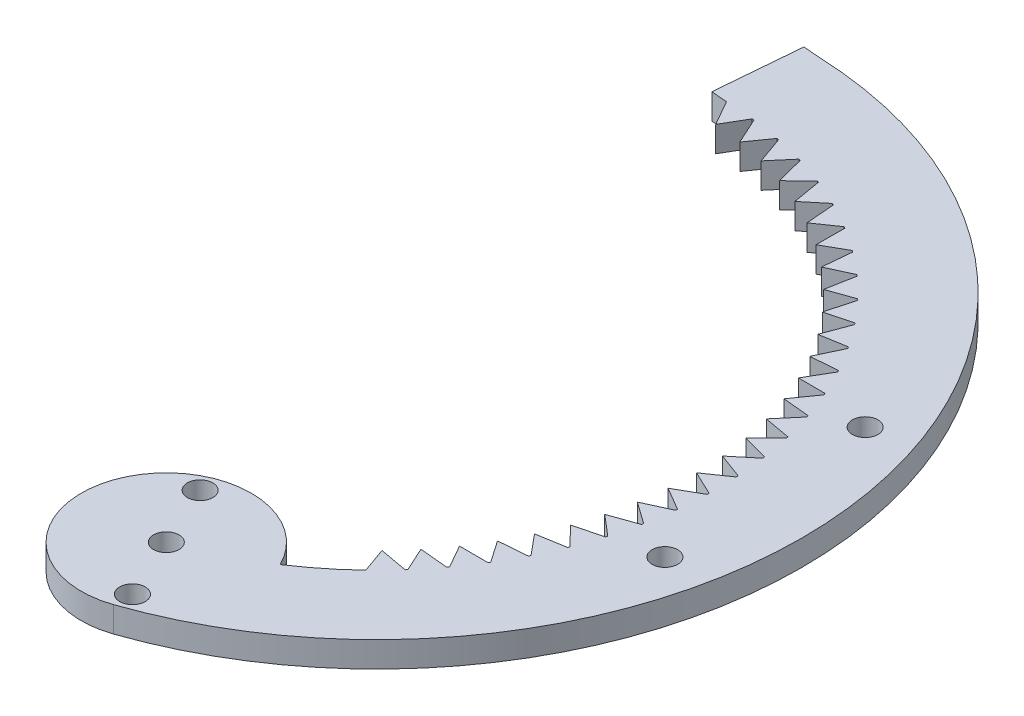
from build123d import *

# Parameters (mm, degrees)
SKETCH_1_R          = 1.5
EXTRUDE_1_DEPTH     = 3
SKETCH_2_R          = 1.5
CUT_EXTRUDE_1_DEPTH = 35
SKETCH_3_R          = 1.5
CUT_EXTRUDE_2_DEPTH = 10


with BuildPart() as part:
    # 草图1 → 凸台-拉伸1 (new body)
    with BuildSketch(Plane(origin=(0, 0, 0), x_dir=(1, 0, 0), z_dir=(0, 1, 0))):
        with BuildLine():
            Line((-11.919787954, 77.793366188), (-10.248955421, 74.860550413))
            Line((-10.248955421, 74.860550413), (-8.665067312, 77.567824645))
            ThreePointArc((-8.665067312, 77.567824645), (-8.552157803, 77.555194327), (-8.439284624, 77.542243357))
            Line((-8.439284624, 77.542243357), (-7.03042185, 74.474965181))
            Line((-7.03042185, 74.474965181), (-5.216606417, 77.033892473))
            ThreePointArc((-5.216606417, 77.033892473), (-5.105227368, 77.011469504), (-4.993912457, 76.988730272))
            Line((-4.993912457, 76.988730272), (-3.857741739, 73.810333533))
            Line((-3.857741739, 73.810333533), (-1.827803212, 76.201438903))
            ThreePointArc((-1.827803212, 76.201438903), (-1.718802284, 76.169393937), (-1.609892815, 76.1370395))
            Line((-1.609892815, 76.1370395), (-0.755061098, 72.871713718))
            Line((-0.755061098, 72.871713718), (1.475551464, 75.07679941))
            ThreePointArc((1.475551464, 75.07679941), (1.581344708, 75.035376328), (1.687019869, 74.993652924))
            Line((1.687019869, 74.993652924), (2.254006799, 71.666249199))
            Line((2.254006799, 71.666249199), (4.668317088, 73.66853318))
            ThreePointArc((4.668317088, 73.66853318), (4.770097497, 73.618047236), (4.871734098, 73.567272405))
            Line((4.871734098, 73.567272405), (5.146561129, 70.203114289))
            Line((5.146561129, 70.203114289), (7.726194786, 71.987357968))
            ThreePointArc((7.726194786, 71.987357968), (7.82318775, 71.928193392), (7.920012274, 71.868753561))
            Line((7.920012274, 71.868753561), (7.900587806, 68.493444328))
            Line((7.900587806, 68.493444328), (10.625912261, 70.046068534))
            ThreePointArc((10.625912261, 70.046068534), (10.717379605, 69.978675602), (10.808655161, 69.911023145))
            Line((10.808655161, 69.911023145), (10.495127025, 66.550250936))
            Line((10.495127025, 66.550250936), (13.345400914, 67.859439261))
            ThreePointArc((13.345400914, 67.859439261), (13.430646516, 67.784330876), (13.51567844, 67.708980668))
            Line((13.51567844, 67.708980668), (12.910432776, 64.38832299))
            Line((12.910432776, 64.38832299), (15.863963793, 65.44411172))
            ThreePointArc((15.863963793, 65.44411172), (15.942338882, 65.361859501), (16.020480031, 65.279385002))
            Line((16.020480031, 65.279385002), (15.128123123, 62.024114065))
            Line((15.128123123, 62.024114065), (18.162433114, 62.818468011))
            ThreePointArc((18.162433114, 62.818468011), (18.233341209, 62.729697948), (18.303996881, 62.640726839))
            Line((18.303996881, 62.640726839), (17.131320104, 59.47561722))
            Line((17.131320104, 59.47561722), (20.223316137, 60.002490868))
            ThreePointArc((20.223316137, 60.002490868), (20.286217585, 59.907878554), (20.348850048, 59.81308796))
            Line((20.348850048, 59.81308796), (18.90477818, 56.762228053))
            Line((18.90477818, 56.762228053), (22.030928299, 57.017611578))
            ThreePointArc((22.030928299, 57.017611578), (22.085344382, 56.917877069), (22.139476964, 56.817988403))
            Line((22.139476964, 56.817988403), (20.435000265, 53.904597096))
            Line((20.435000265, 53.904597096), (23.57151258, 53.886546873))
            ThreePointArc((23.57151258, 53.886546873), (23.617029157, 53.782449211), (23.662249878, 53.678222686))
            Line((23.662249878, 53.678222686), (21.710340444, 50.924472645))
            Line((21.710340444, 50.924472645), (24.833344202, 50.633126049))
            ThreePointArc((24.833344202, 50.633126049), (24.869614866, 50.525457478), (24.905579569, 50.417686321))
            Line((24.905579569, 50.417686321), (22.721092609, 47.844535247))
            Line((22.721092609, 47.844535247), (25.806819865, 47.2821096))
            ThreePointArc((25.806819865, 47.2821096), (25.833568575, 47.171689544), (25.860003545, 47.061193959))
            Line((25.860003545, 47.061193959), (23.459564325, 44.688225085))
            Line((23.459564325, 44.688225085), (26.484530833, 43.859000786))
            ThreePointArc((26.484530833, 43.859000786), (26.501554013, 43.746669609), (26.518258066, 43.634290532))
            Line((26.518258066, 43.634290532), (23.920135376, 41.479563585))
            Line((23.920135376, 41.479563585), (26.861319314, 40.389851532))
            ThreePointArc((26.861319314, 40.389851532), (26.868487408, 40.276464141), (26.875333415, 40.163056847))
            Line((26.875333415, 40.163056847), (24.09930054, 38.242970598))
            Line((24.09930054, 38.242970598), (26.934317721, 36.901064158))
            ThreePointArc((26.934317721, 36.901064158), (26.931576177, 36.7874835), (26.928512036, 36.673911086))
            Line((26.928512036, 36.673911086), (23.99569626, 35.003078552))
            Line((23.99569626, 35.003078552), (26.702970493, 33.419190443))
            ThreePointArc((26.702970493, 33.419190443), (26.690340174, 33.306280935), (26.677389205, 33.193407756))
            Line((26.677389205, 33.193407756), (23.610111028, 31.784544982))
            Line((23.610111028, 31.784544982), (26.16903832, 29.970729549))
            ThreePointArc((26.16903832, 29.970729549), (26.146615352, 29.8593505), (26.123876119, 29.748035589))
            Line((26.123876119, 29.748035589), (22.945479381, 28.611864871))
            Line((22.945479381, 28.611864871), (25.336584751, 26.581926344))
            ThreePointArc((25.336584751, 26.581926344), (25.304539784, 26.472925416), (25.272185348, 26.364015947))
            Line((25.272185348, 26.364015947), (22.006859566, 25.50918423))
            Line((22.006859566, 25.50918423), (24.211945258, 23.278571668))
            ThreePointArc((24.211945258, 23.278571668), (24.170522175, 23.172778424), (24.128798771, 23.067103263))
            Line((24.128798771, 23.067103263), (20.801395047, 22.500116333))
            Line((20.801395047, 22.500116333), (22.803679027, 20.085806044))
            ThreePointArc((22.803679027, 20.085806044), (22.753193083, 19.984025635), (22.702418252, 19.882389034))
            Line((22.702418252, 19.882389034), (19.338260136, 19.607562003))
            Line((19.338260136, 19.607562003), (21.122503815, 17.027928346))
            ThreePointArc((21.122503815, 17.027928346), (21.063339239, 16.930935382), (21.003899408, 16.834110857))
            Line((21.003899408, 16.834110857), (17.628590175, 16.853535326))
            Line((17.628590175, 16.853535326), (19.181214381, 14.12821087))
            ThreePointArc((19.181214381, 14.12821087), (19.11382145, 14.036743527), (19.046168992, 13.945467971))
            Line((19.046168992, 13.945467971), (15.685396784, 14.258996107))
            Line((15.685396784, 14.258996107), (16.994585109, 11.408722218))
            ThreePointArc((16.994585109, 11.408722218), (16.919476724, 11.323476616), (16.844126515, 11.238444692))
            Line((16.844126515, 11.238444692), (13.523468837, 11.843690356))
            Line((13.523468837, 11.843690356), (14.579257567, 8.890159339))
            ThreePointArc((14.579257567, 8.890159339), (11.875157779, 6.528999379), (8.970254591, 4.419788747))
            ThreePointArc((8.970254591, 4.419788747), (-9.248107271, 3.804275476), (3.263841378, -9.452372161))
            ThreePointArc((3.263841378, -9.452372161), (36.41039757, 45.099089654), (-11.063458372, 87.769795947))
            Line((-11.063458372, 87.769795947), (-12.946912918, 87.931462784))
            Line((-12.946912918, 87.931462784), (-13.8032425, 77.955033025))
            Line((-13.8032425, 77.955033025), (-11.919787954, 77.793366188))
        make_face()
        with Locations(Location((0, 0, 0), (0, 0, 270))):
            Circle(SKETCH_1_R, mode=Mode.SUBTRACT)
    extrude(amount=EXTRUDE_1_DEPTH)

    # 草图2 → 切除-拉伸1 (cut)
    with BuildSketch(Plane(origin=(0, 3, 0), x_dir=(1, 0, 0), z_dir=(0, 1, 0))):
        with Locations(Location((-3.307239505, 7.284378275, 0), (0, 0, 270))):
            Circle(SKETCH_2_R)
        with Locations(Location((3.307239505, -7.284378275, 0), (0, 0, 270))):
            Circle(SKETCH_2_R)
    extrude(amount=-CUT_EXTRUDE_1_DEPTH, mode=Mode.SUBTRACT)

    # 草图3 → 切除-拉伸2 (cut)
    with BuildSketch(Plane(origin=(0, 3, 0), x_dir=(1, 0, 0), z_dir=(0, 1, 0))):
        with Locations(Location((30.819456427, 27.809488642, 0), (0, 0, 270))):
            Circle(SKETCH_3_R)
        with Locations(Location((29.371041361, 52.809488642, 0), (0, 0, 270))):
            Circle(SKETCH_3_R)
    extrude(amount=-CUT_EXTRUDE_2_DEPTH, mode=Mode.SUBTRACT)


solid = part.part
